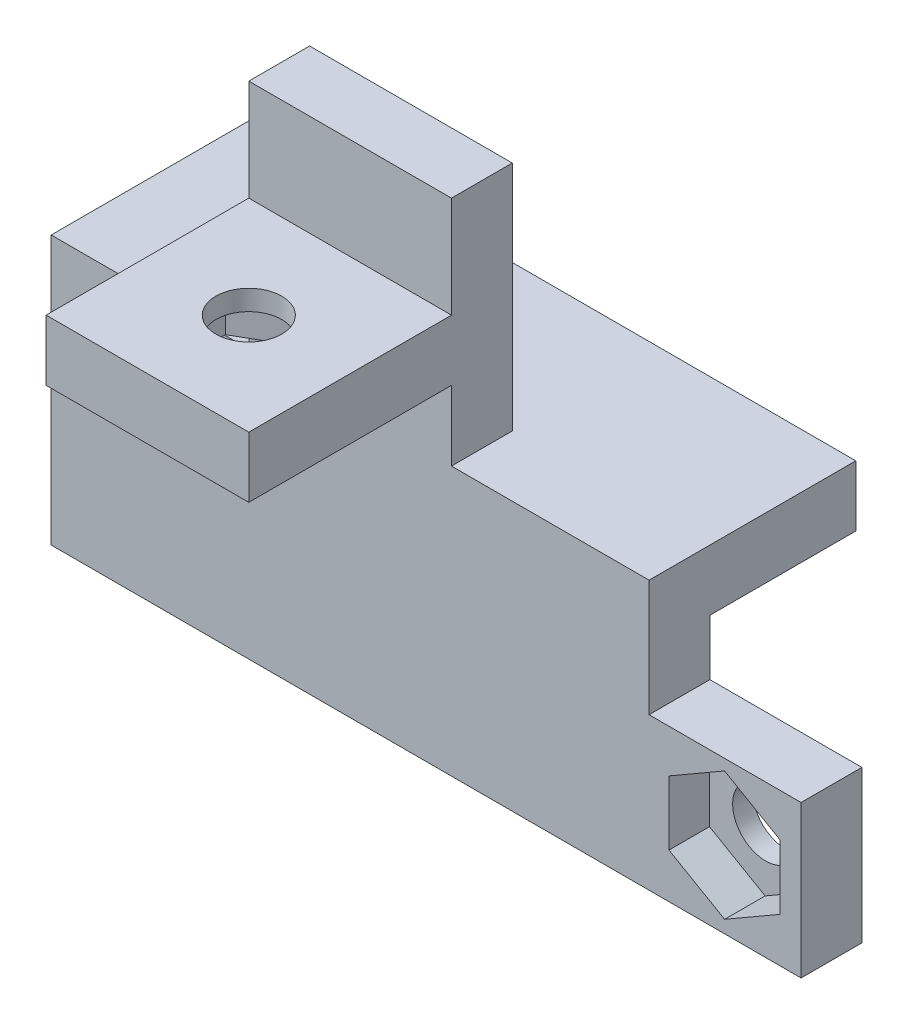
from build123d import *

# Parameters (mm, degrees)
CROQUIS1_R              = 1.625
SALIENTE_EXTRUIR1_DEPTH = 3
CORTAR_EXTRUIR1_DEPTH   = 2
CROQUIS4_W              = 29.5
CROQUIS4_H              = 10.2
SALIENTE_EXTRUIR2_DEPTH = 3
SALIENTE_EXTRUIR3_DEPTH = 3
CROQUIS7_W              = 10
CROQUIS7_H              = 3
SALIENTE_EXTRUIR4_DEPTH = 5
CROQUIS9_W              = 10
CROQUIS9_H              = 3
SALIENTE_EXTRUIR5_DEPTH = 10
CROQUIS10_R             = 1.625
CORTAR_EXTRUIR2_DEPTH   = 3
CORTAR_EXTRUIR3_DEPTH   = 2


with BuildPart() as part:
    # Croquis1 → Saliente-Extruir1 (new body)
    with BuildSketch(Plane.XY):
        Polygon((-40.458841365, -24.7), (-77.458841365, -24.7), (-77.458841365, -14.45), (-47.958841365, -14.45), (-47.958841365, -17.2), (-40.458841365, -17.2), align=None)
        with Locations((-44.208841365, -20.95)):
            Circle(CROQUIS1_R, mode=Mode.SUBTRACT)
    extrude(amount=SALIENTE_EXTRUIR1_DEPTH)

    # Croquis2 → Cortar-Extruir1 (cut)
    with BuildSketch(Plane.XY.offset(3)):
        Polygon((-44.232492922, -17.739034302), (-46.977793452, -19.324034302), (-46.977793452, -22.494034302), (-44.232492922, -24.079034302), (-41.487192392, -22.494034302), (-41.487192392, -19.324034302), align=None)
    extrude(amount=-CORTAR_EXTRUIR1_DEPTH, mode=Mode.SUBTRACT)

    # Croquis4 → Saliente-Extruir2 (add)
    with BuildSketch(Plane(origin=(0, -14.45, 0), x_dir=(1, 0, 0), z_dir=(0, 1, 0))):
        with Locations((-62.708841365, 2.1)):
            Rectangle(CROQUIS4_W, CROQUIS4_H)
    extrude(amount=SALIENTE_EXTRUIR2_DEPTH)

    # Croquis6 → Saliente-Extruir3 (add)
    with BuildSketch(Plane.XY.offset(3)):
        Polygon((-62.708841365, -11.45), (-67.708841365, -11.45), (-67.708841365, -5), (-57.708841365, -5), (-57.708841365, -11.45), align=None)
    extrude(amount=-SALIENTE_EXTRUIR3_DEPTH)

    # Croquis7 → Saliente-Extruir4 (add)
    with BuildSketch(Plane(origin=(0, -5, 0), x_dir=(1, 0, 0), z_dir=(0, 1, 0))):
        with Locations((-62.708841365, -1.5)):
            Rectangle(CROQUIS7_W, CROQUIS7_H)
    extrude(amount=SALIENTE_EXTRUIR4_DEPTH)

    # Croquis9 → Saliente-Extruir5 (add)
    with BuildSketch(Plane.XY.offset(3)):
        with Locations((-62.708841365, -6.5)):
            Rectangle(CROQUIS9_W, CROQUIS9_H)
    extrude(amount=SALIENTE_EXTRUIR5_DEPTH)

    # Croquis10 → Cortar-Extruir2 (cut)
    with BuildSketch(Plane.XZ.offset(8)):
        with Locations(Location((-62.708841365, 8, 0), (0, 0, 270))):
            Circle(CROQUIS10_R)
    extrude(amount=-CORTAR_EXTRUIR2_DEPTH, mode=Mode.SUBTRACT)

    # Croquis11 → Cortar-Extruir3 (cut)
    with BuildSketch(Plane.XZ.offset(8)):
        Polygon((-62.708841365, 4.83), (-59.963540835, 6.415), (-59.963540835, 9.585), (-62.708841365, 11.17), (-65.454141895, 9.585), (-65.454141895, 6.415), align=None)
    extrude(amount=-CORTAR_EXTRUIR3_DEPTH, mode=Mode.SUBTRACT)


solid = part.part
